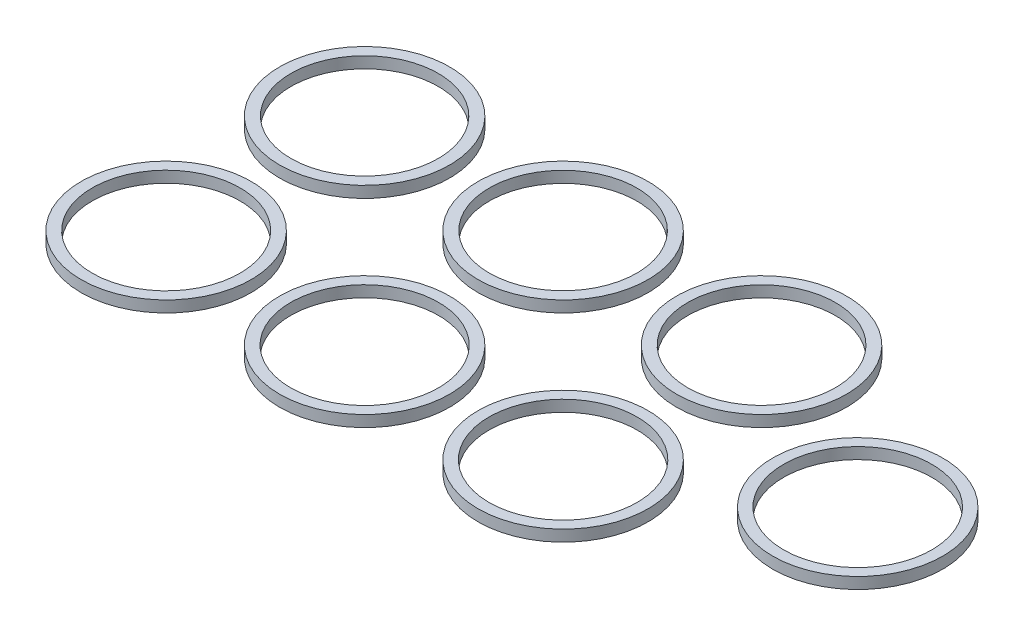
from build123d import *

# Parameters (mm, degrees)
SKETCH1_R             = 30
SKETCH1_R_2           = 26
BOSS_EXTRUDE1_DEPTH   = 4
SKETCH1_R_3           = 26.025
BOSS_EXTRUDE1_2_DEPTH = 4
SKETCH1_R_4           = 26.05
BOSS_EXTRUDE1_3_DEPTH = 4
SKETCH1_R_5           = 26.1
BOSS_EXTRUDE1_4_DEPTH = 4
SKETCH1_R_6           = 26.125
BOSS_EXTRUDE1_5_DEPTH = 4
SKETCH1_R_7           = 26.075
BOSS_EXTRUDE1_6_DEPTH = 4
SKETCH1_R_8           = 26.15
BOSS_EXTRUDE1_7_DEPTH = 4


with BuildPart() as part:
    # Sketch1 → Boss-Extrude1 (new body)
    with BuildSketch(Plane(origin=(0, 0, 0), x_dir=(1, 0, 0), z_dir=(0, 1, 0))):
        with Locations(Location((0, 0, 0), (0, 0, 270))):
            Circle(SKETCH1_R)
        with Locations(Location((0, 0, 0), (0, 0, 270))):
            Circle(SKETCH1_R_2, mode=Mode.SUBTRACT)
    extrude(amount=BOSS_EXTRUDE1_DEPTH)


with BuildPart() as body_2:
    # Sketch1 → Boss-Extrude1 2 (new body)
    with BuildSketch(Plane(origin=(0, 0, 0), x_dir=(1, 0, 0), z_dir=(0, 1, 0))):
        with Locations(Location((70, 0, 0), (0, 0, 270))):
            Circle(SKETCH1_R)
        with Locations(Location((70, 0, 0), (0, 0, 270))):
            Circle(SKETCH1_R_3, mode=Mode.SUBTRACT)
    extrude(amount=BOSS_EXTRUDE1_2_DEPTH)


with BuildPart() as body_3:
    # Sketch1 → Boss-Extrude1 3 (new body)
    with BuildSketch(Plane(origin=(0, 0, 0), x_dir=(1, 0, 0), z_dir=(0, 1, 0))):
        with Locations(Location((140, 0, 0), (0, 0, 270))):
            Circle(SKETCH1_R)
        with Locations(Location((140, 0, 0), (0, 0, 270))):
            Circle(SKETCH1_R_4, mode=Mode.SUBTRACT)
    extrude(amount=BOSS_EXTRUDE1_3_DEPTH)


with BuildPart() as body_4:
    # Sketch1 → Boss-Extrude1 4 (new body)
    with BuildSketch(Plane(origin=(0, 0, 0), x_dir=(1, 0, 0), z_dir=(0, 1, 0))):
        with Locations(Location((70, -70, 0), (0, 0, 270))):
            Circle(SKETCH1_R)
        with Locations(Location((70, -70, 0), (0, 0, 270))):
            Circle(SKETCH1_R_5, mode=Mode.SUBTRACT)
    extrude(amount=BOSS_EXTRUDE1_4_DEPTH)


with BuildPart() as body_5:
    # Sketch1 → Boss-Extrude1 5 (new body)
    with BuildSketch(Plane(origin=(0, 0, 0), x_dir=(1, 0, 0), z_dir=(0, 1, 0))):
        with Locations(Location((140, -70, 0), (0, 0, 270))):
            Circle(SKETCH1_R)
        with Locations(Location((140, -70, 0), (0, 0, 270))):
            Circle(SKETCH1_R_6, mode=Mode.SUBTRACT)
    extrude(amount=BOSS_EXTRUDE1_5_DEPTH)


with BuildPart() as body_6:
    # Sketch1 → Boss-Extrude1 6 (new body)
    with BuildSketch(Plane(origin=(0, 0, 0), x_dir=(1, 0, 0), z_dir=(0, 1, 0))):
        with Locations(Location((0, -70, 0), (0, 0, 270))):
            Circle(SKETCH1_R)
        with Locations(Location((0, -70, 0), (0, 0, 270))):
            Circle(SKETCH1_R_7, mode=Mode.SUBTRACT)
    extrude(amount=BOSS_EXTRUDE1_6_DEPTH)


with BuildPart() as body_7:
    # Sketch1 → Boss-Extrude1 7 (new body)
    with BuildSketch(Plane(origin=(0, 0, 0), x_dir=(1, 0, 0), z_dir=(0, 1, 0))):
        with Locations(Location((206.424153942, -32.507740778, 0), (0, 0, 270))):
            Circle(SKETCH1_R)
        with Locations(Location((206.424153942, -32.507740778, 0), (0, 0, 270))):
            Circle(SKETCH1_R_8, mode=Mode.SUBTRACT)
    extrude(amount=BOSS_EXTRUDE1_7_DEPTH)


solid = Compound([part.part, body_2.part, body_3.part, body_4.part, body_5.part, body_6.part, body_7.part])
